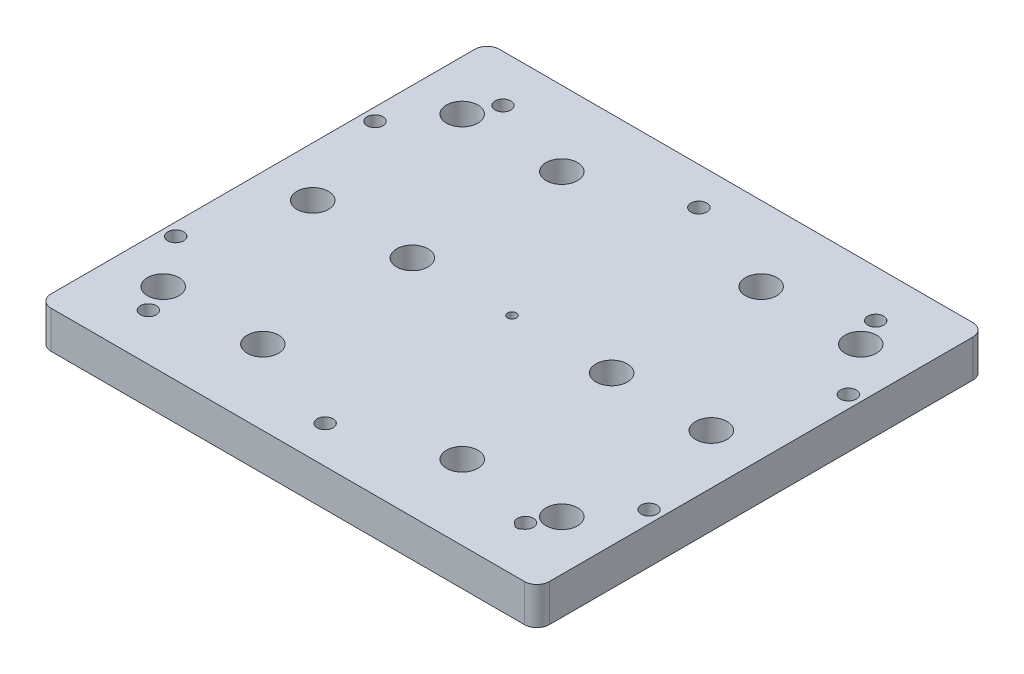
from build123d import *

# Parameters (mm, degrees)
SKETCH1_W                       = 127
SKETCH1_H                       = 114.3
STOCK_DEPTH                     = 9.525
NUC_STANDOFFS_D                 = 2.2606
COVER_MOUNT_D                   = 2.2606
FILLET1_R                       = 3.175
LIDAR_BOX_MOUNT_D               = 2.2606
F_1_4_20_TAPPED_HOLE1_D         = 5.1054
F_21_0_159_DIAMETER_HOLE1_D     = 4.0386
F_21_0_159_DIAMETER_HOLE1_DEPTH = 9.525
O_0_316_DIAMETER_HOLE1_D        = 8.0264
O_0_316_DIAMETER_HOLE1_DEPTH    = 9.525


with BuildPart() as part:
    # Sketch1 → stock (new body)
    with BuildSketch(Plane(origin=(0, 0, 0), x_dir=(1, 0, 0), z_dir=(0, 1, 0))):
        Rectangle(SKETCH1_W, SKETCH1_H)
    extrude(amount=STOCK_DEPTH)

    # NUC standoffs (through all)
    with Locations(Plane(origin=(0, 9.525, 0), x_dir=(1, 0, 0), z_dir=(0, 1, 0))):
        with Locations((-47.499999996, 45.200000024), (-47.499999996, -45.200000024), (47.499999996, -45.200000024), (47.499999996, 45.200000024), (0, 0)):
            Hole(NUC_STANDOFFS_D / 2)

    # Cover mount (through all)
    with Locations(Plane(origin=(0, 9.525, 0), x_dir=(1, 0, 0), z_dir=(0, 1, 0))):
        with Locations((60.325, 25.4), (60.325, -25.4), (-60.325, -25.4), (-60.325, 25.4), (0, 0)):
            Hole(COVER_MOUNT_D / 2)

    # Fillet1
    fillet1_edges = [part.edges().sort_by_distance(p)[0] for p in [
        (-63.5, 4.7625, -57.15),
        (63.5, 4.7625, -57.15),
        (63.5, 4.7625, 57.15),
        (-63.5, 4.7625, 57.15),
    ]]
    fillet(fillet1_edges, radius=FILLET1_R)

    # lidar box mount (through all)
    with Locations(Plane(origin=(0, 9.525, 0), x_dir=(1, 0, 0), z_dir=(0, 1, 0))):
        with Locations((0, -47.625), (0, 47.625)):
            Hole(LIDAR_BOX_MOUNT_D / 2)

    # 1/4-20 Tapped Hole1 (through all)
    with Locations(Plane(origin=(50.8, 0, -38.1), x_dir=(0, 0, -1), z_dir=(0, -1, 0))):
        with Locations((0, 0), (0, -25.4), (-38.1, -25.4), (-38.1, 0), (-76.2, 0), (-76.2, -25.4), (-76.2, -76.2), (-76.2, -101.6), (-38.1, -101.6), (-38.1, -76.2), (0, -76.2), (0, -101.6)):
            Hole(F_1_4_20_TAPPED_HOLE1_D / 2)

    # #21 (0.159) Diameter Hole1
    with Locations(Plane(origin=(0, 0, 0), x_dir=(-1, 0, 0), z_dir=(0, -1, 0))):
        with Locations((-47.499999996, 45.200000024), (-60.325, 25.4), (-60.325, -25.4), (-47.499999996, -44.069700024), (0, -47.625), (47.499999996, -45.200000024), (60.325, -25.4), (60.325, 25.4), (47.499999996, 45.200000024), (0, 47.625)):
            Hole(F_21_0_159_DIAMETER_HOLE1_D / 2, depth=F_21_0_159_DIAMETER_HOLE1_DEPTH)

    # O (0.316) Diameter Hole1
    with Locations(Plane(origin=(0, 0, 0), x_dir=(-1, 0, 0), z_dir=(0, -1, 0))):
        with Locations((-50.8, 38.1), (-25.4, 38.1), (-25.4, 0), (-50.8, 0), (-50.8, -38.1), (-25.4, -38.1), (25.4, -38.1), (50.8, -38.1), (50.8, 0), (25.4, 0), (25.4, 38.1), (50.8, 38.1)):
            Hole(O_0_316_DIAMETER_HOLE1_D / 2, depth=O_0_316_DIAMETER_HOLE1_DEPTH)


solid = part.part
